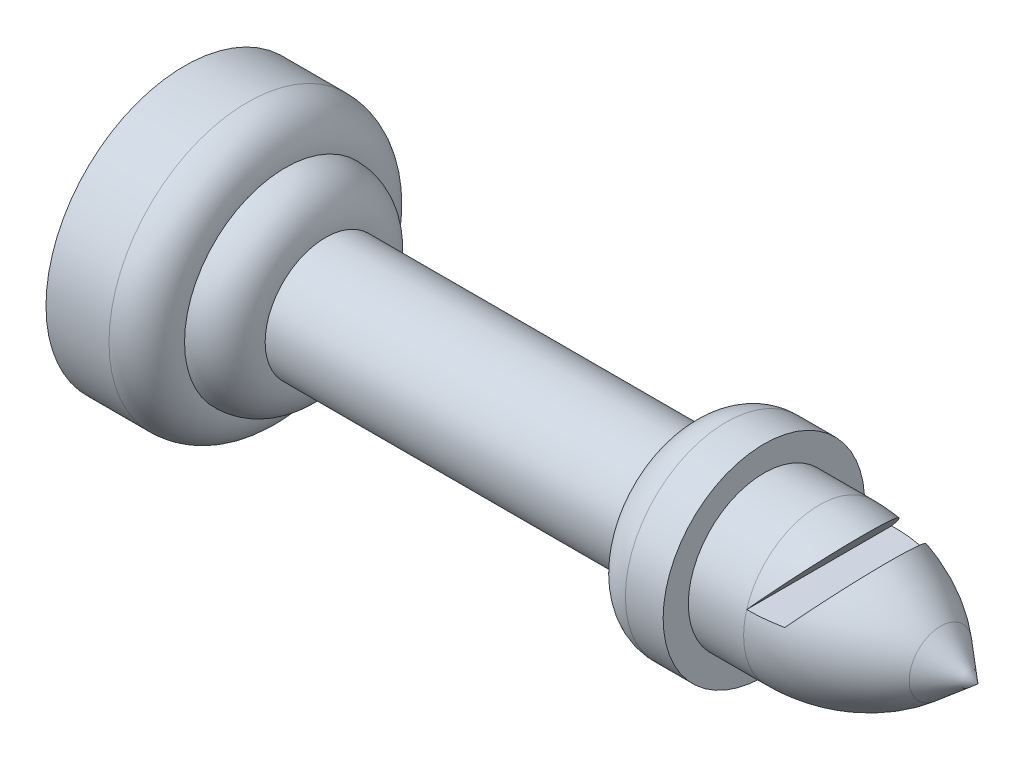
from build123d import *

# Parameters (mm, degrees)
CUT_EXTRUDE_1_DEPTH = 10
SKETCH_5_R          = 10
CUT_EXTRUDE_2_DEPTH = 2.5


with BuildPart() as part:
    # Эскиз1 → Повернуть1 (revolve)
    with BuildSketch(Plane.XY, mode=Mode.PRIVATE) as revolve_1_sk:
        Polygon((5, 11), (0, 11), (0, 0), (5, 0), (5, 3), align=None)
        Polygon((8, 11), (5, 11), (5, 3), (8, 3), (8, 6.2), align=None)
        with BuildLine():
            Line((8, 3), (5, 3))
            Line((5, 3), (5, 0))
            ThreePointArc((5, 0), (7.121320344, 0.878679656), (8, 3))
        make_face()
        with BuildLine():
            Line((11.2, 6.2), (8, 6.2))
            Line((8, 6.2), (8, 3))
            ThreePointArc((8, 3), (10.2627417, 3.9372583), (11.2, 6.2))
        make_face()
        Polygon((43, 11), (8, 11), (8, 6.2), (11.2, 6.2), (39.8, 6.2), (43, 6.2), align=None)
        with BuildLine():
            Line((43, 3), (43, 6.2))
            Line((43, 6.2), (39.8, 6.2))
            ThreePointArc((39.8, 6.2), (40.7372583, 3.9372583), (43, 3))
        make_face()
        Polygon((46, 11), (43, 11), (43, 6.2), (43, 3), (46, 3), (46, 5), (46, 9), align=None)
        with BuildLine():
            Line((63, 11), (46, 11))
            Line((46, 11), (46, 9))
            Line((46, 9), (46, 5))
            Line((46, 5), (50.38992493, 5))
            ThreePointArc((50.38992493, 5), (55.52022708, 5.904610688), (60.031739076, 8.509333353))
            Line((60.031739076, 8.509333353), (63, 11))
        make_face()
    revolve(revolve_1_sk.sketch.rotate(Axis((0, 11, 0), (1, 0, 0)), 270), axis=Axis((0, 11, 0), (1, 0, 0)))

    # Эскиз2 → Вырез-Вытянуть1 (cut)
    with BuildSketch(Plane.XY):
        Polygon((50.38992493, 12.688629435), (54.167703604, 17), (55.999437229, 15.951404954), (53.140475424, 12.688629435), align=None)
    cut_extrude_1 = extrude(amount=-CUT_EXTRUDE_1_DEPTH, mode=Mode.SUBTRACT)

    # Зеркальное отражение1: Вырез-Вытянуть1 across plane
    add(cut_extrude_1.mirror(Plane.XY), mode=Mode.SUBTRACT)

    # Эскиз5 → Вырез-Вытянуть2 (cut)
    with BuildSketch(Plane.ZY):
        with Locations((0, 11)):
            Circle(SKETCH_5_R)
    extrude(amount=-CUT_EXTRUDE_2_DEPTH, mode=Mode.SUBTRACT)


solid = part.part
